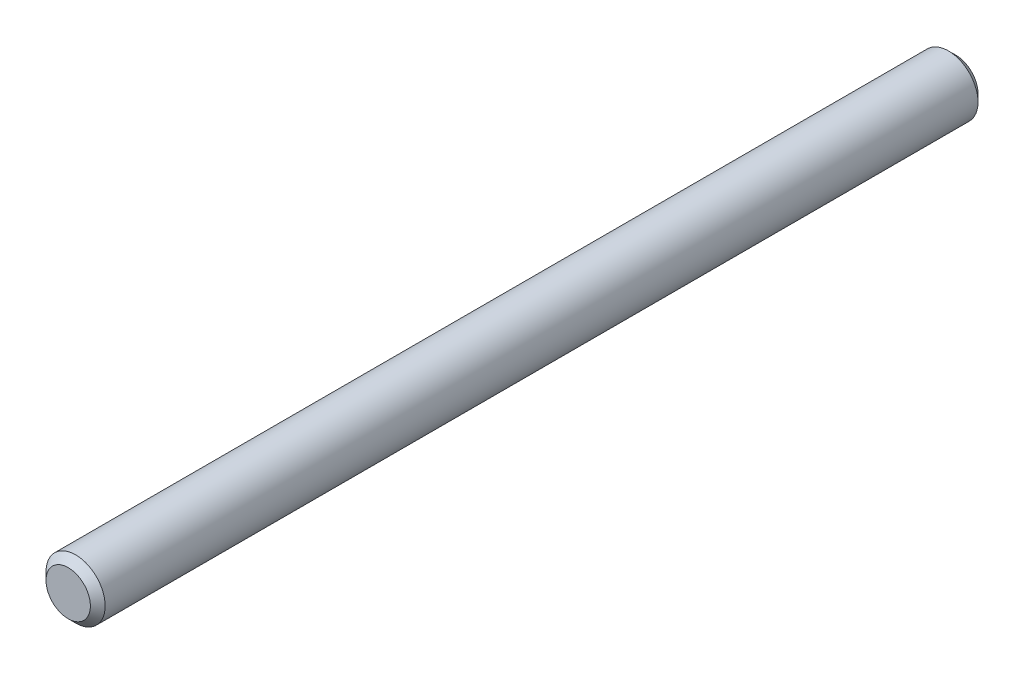
from build123d import *

# Parameters (mm, degrees)
SKETCH_1_R      = 2
EXTRUDE_1_DEPTH = 60
CHAMFER_1_SIZE  = 0.5


with BuildPart() as part:
    # 草图1 → 凸台-拉伸1 (new body)
    with BuildSketch(Plane.XY):
        Circle(SKETCH_1_R)
    extrude(amount=-EXTRUDE_1_DEPTH)

    # 倒角1
    chamfer_1_edges = [part.edges().sort_by_distance(p)[0] for p in [
        (-2, 0, 0),
        (-2, 0, -60),
    ]]
    chamfer(chamfer_1_edges, length=CHAMFER_1_SIZE)


solid = part.part
